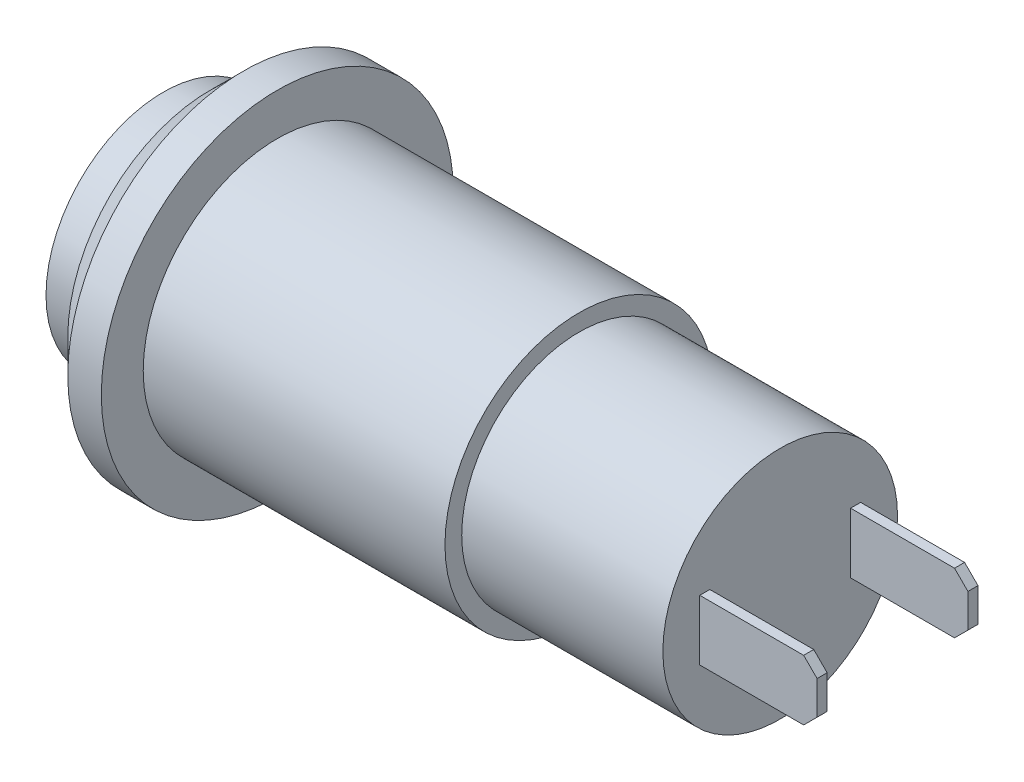
from build123d import *

# Parameters (mm, degrees)
CHAMFER_1_SIZE  = 1
SKETCH_2_W      = 0.3
SKETCH_2_H      = 1.8
EXTRUDE_1_DEPTH = 3.5
CHAMFER_2_SIZE  = 0.4


with BuildPart() as part:
    # 草图1 → 旋转1 (revolve)
    with BuildSketch(Plane.XY, mode=Mode.PRIVATE) as revolve_1_sk:
        Polygon((0, 0), (0, 3.5), (1.4, 3.5), (1.4, 5.25), (3.4, 5.25), (3.4, 4), (12.4, 4), (12.4, 3.5), (18.4, 3.5), (18.4, 0), align=None)
    revolve(revolve_1_sk.sketch.rotate(Axis((18.4, 0, 0), (-1, 0, 0)), 90), axis=Axis((18.4, 0, 0), (-1, 0, 0)))

    # 倒角1
    chamfer_1_edges = [part.edges().sort_by_distance(p)[0] for p in [
        (1.4, 0, 5.25),
    ]]
    chamfer(chamfer_1_edges, length=CHAMFER_1_SIZE)

    # 草图2 → 凸台-拉伸1 (add)
    with BuildSketch(Plane(origin=(18.4, 0, 0), x_dir=(0, 0, -1), z_dir=(1, 0, 0))):
        with Locations((-2.25, 0)):
            Rectangle(SKETCH_2_W, SKETCH_2_H)
        with Locations((2.25, 0)):
            Rectangle(SKETCH_2_W, SKETCH_2_H)
    extrude(amount=EXTRUDE_1_DEPTH)

    # 倒角2
    chamfer_2_edges = [part.edges().sort_by_distance(p)[0] for p in [
        (21.9, 0.9, 2.25),
        (21.9, -0.9, 2.25),
        (21.9, 0.9, -2.25),
        (21.9, -0.9, -2.25),
    ]]
    chamfer(chamfer_2_edges, length=CHAMFER_2_SIZE)


solid = part.part
